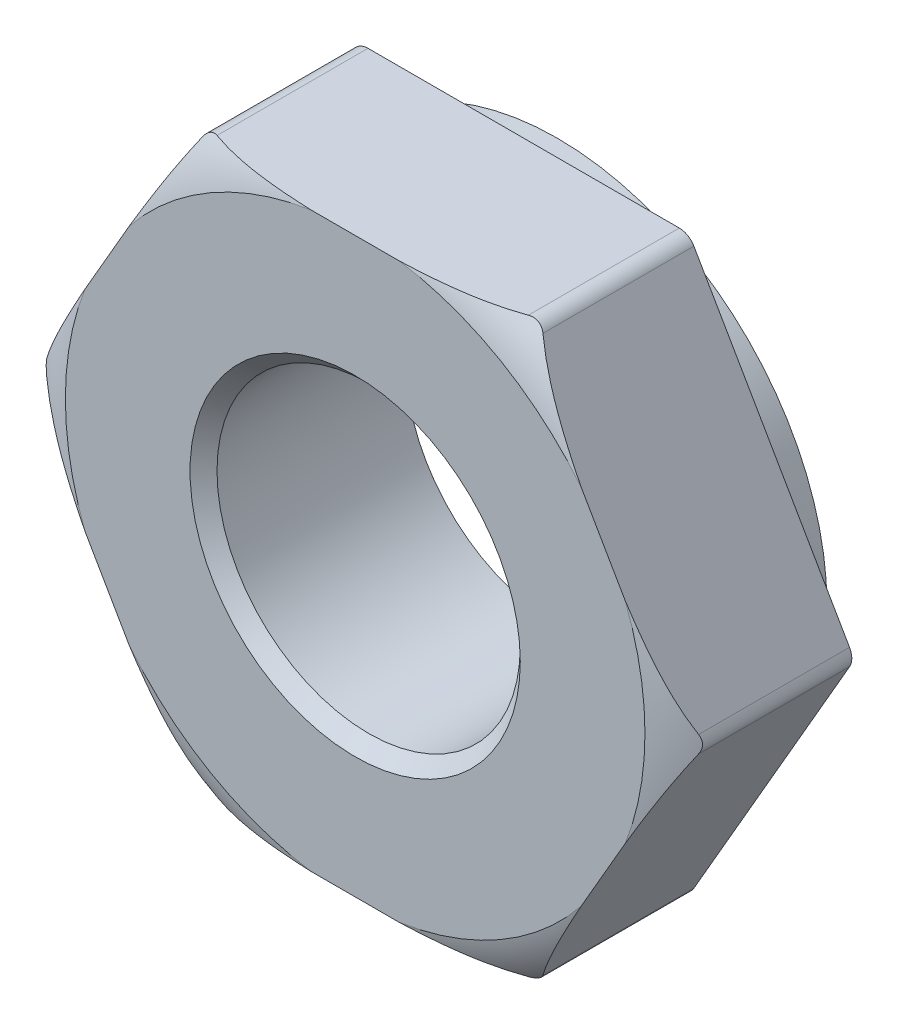
from build123d import *

# Parameters (mm, degrees)
ESQUISSE2_R             = 11.85785331
ENL_V_MAT_EXTRU_1_DEPTH = 10


with BuildPart() as part:
    # Esquisse1 → Révolution1 (revolve)
    with BuildSketch(Plane(origin=(0, 0, 0), x_dir=(0, 0, -1), z_dir=(1, 0, 0))):
        with BuildLine():
            Line((-1.6, 4.5), (4, 4.5))
            Line((4, 4.5), (4, 8))
            Line((4, 8), (3, 8))
            Line((3, 8), (2.7, 8))
            Line((2.7, 8), (2.7, 8.4))
            Line((2.7, 8.4), (3, 8.4))
            Line((3, 8.4), (3, 9.774245233))
            ThreePointArc((3, 9.774245233), (2.898746035, 9.889790175), (2.791709623, 10))
            Line((2.791709623, 10), (-1.191709623, 10))
            ThreePointArc((-1.191709623, 10), (-1.691931822, 9.355470088), (-2, 8.6))
            Line((-2, 8.6), (-2, 4.9))
            Line((-2, 4.9), (-1.6, 4.5))
        make_face()
    revolve(axis=Axis((0, 0, 15.19936), (0, 0, -1)))

    # Esquisse2 → Enlèv. mat.-Extru.1 (cut)
    with BuildSketch(Plane.XY.offset(2)):
        Circle(ESQUISSE2_R)
        with BuildLine():
            Line((-5.051814855, 8.25), (-9.670617009, 0.25))
            ThreePointArc((-9.670617009, 0.25), (-9.737604307, 0), (-9.670617009, -0.25))
            Line((-9.670617009, -0.25), (-5.051814855, -8.25))
            ThreePointArc((-5.051814855, -8.25), (-4.868802154, -8.433012702), (-4.618802154, -8.5))
            Line((-4.618802154, -8.5), (4.618802154, -8.5))
            ThreePointArc((4.618802154, -8.5), (4.868802154, -8.433012702), (5.051814855, -8.25))
            Line((5.051814855, -8.25), (9.670617009, -0.25))
            ThreePointArc((9.670617009, -0.25), (9.737604307, 0), (9.670617009, 0.25))
            Line((9.670617009, 0.25), (5.051814855, 8.25))
            ThreePointArc((5.051814855, 8.25), (4.868802154, 8.433012702), (4.618802154, 8.5))
            Line((4.618802154, 8.5), (-4.618802154, 8.5))
            ThreePointArc((-4.618802154, 8.5), (-4.868802154, 8.433012702), (-5.051814855, 8.25))
        make_face(mode=Mode.SUBTRACT)
    extrude(amount=-ENL_V_MAT_EXTRU_1_DEPTH, mode=Mode.SUBTRACT)


solid = part.part
